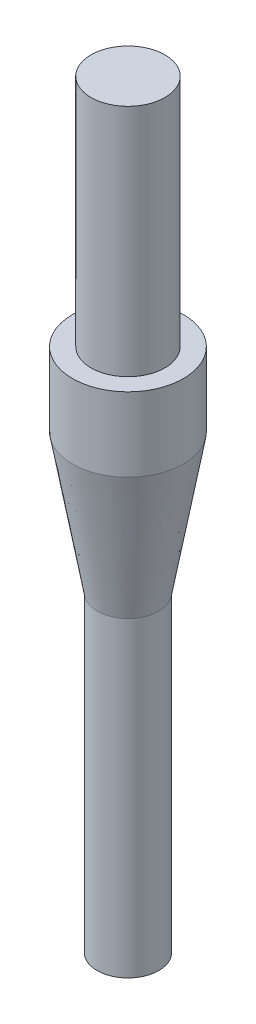
from build123d import *


with BuildPart() as part:
    # Эскиз1 → Повернуть1 (revolve)
    with BuildSketch(Plane(origin=(0, 0, -5.79999466), x_dir=(-1, 0, 0), z_dir=(0, 0, -1)), mode=Mode.PRIVATE) as revolve_1_sk:
        Polygon((-17.59991122, 47), (-19.09991122, 47), (-19.09991122, 37.5), (-19.84991122, 37.5), (-19.84991122, 34.5), (-18.84991122, 28.82871818), (-18.84991122, 16.20115928), (-17.59991122, 16.20115928), align=None)
    revolve(revolve_1_sk.sketch.rotate(Axis((17.59991122, 47, -5.79999466), (0, -1, 0)), 180), axis=Axis((17.59991122, 47, -5.79999466), (0, -1, 0)))


solid = part.part
